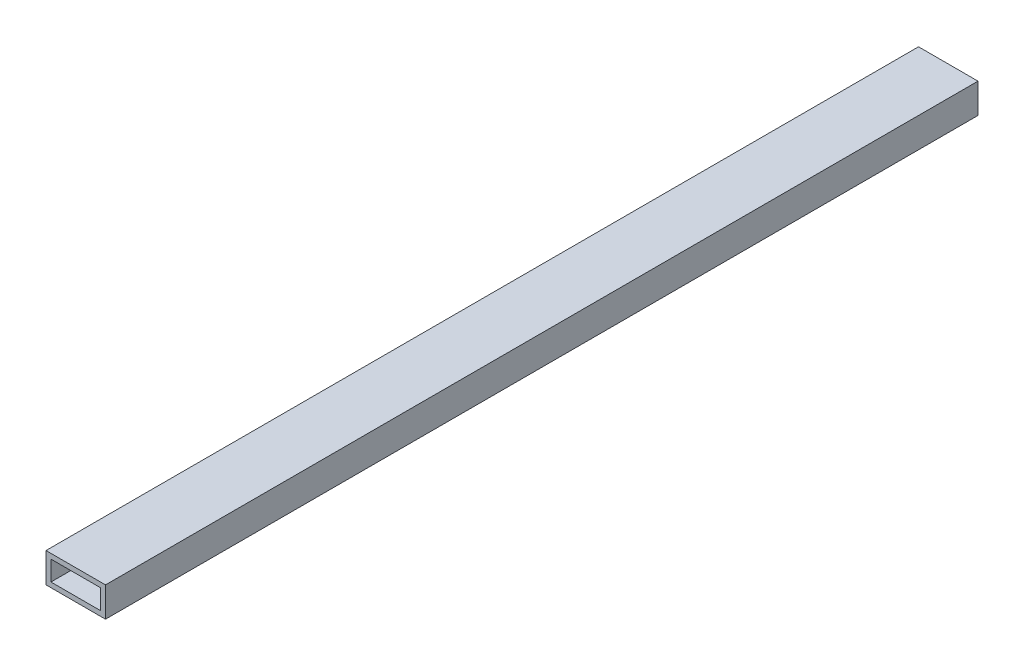
from build123d import *

# Parameters (mm, degrees)
SKETCH1_W           = 38.1
SKETCH1_H           = 19.05
SKETCH1_W_2         = 31.75
SKETCH1_H_2         = 12.7
EXTRUDE_THIN1_DEPTH = 558.8


with BuildPart() as part:
    # Sketch1 → Extrude-Thin1 (new body)
    with BuildSketch(Plane.XY):
        with Locations((19.05, 9.525)):
            Rectangle(SKETCH1_W, SKETCH1_H)
        with Locations((19.05, 9.525)):
            Rectangle(SKETCH1_W_2, SKETCH1_H_2, mode=Mode.SUBTRACT)
    extrude(amount=EXTRUDE_THIN1_DEPTH)


solid = part.part
